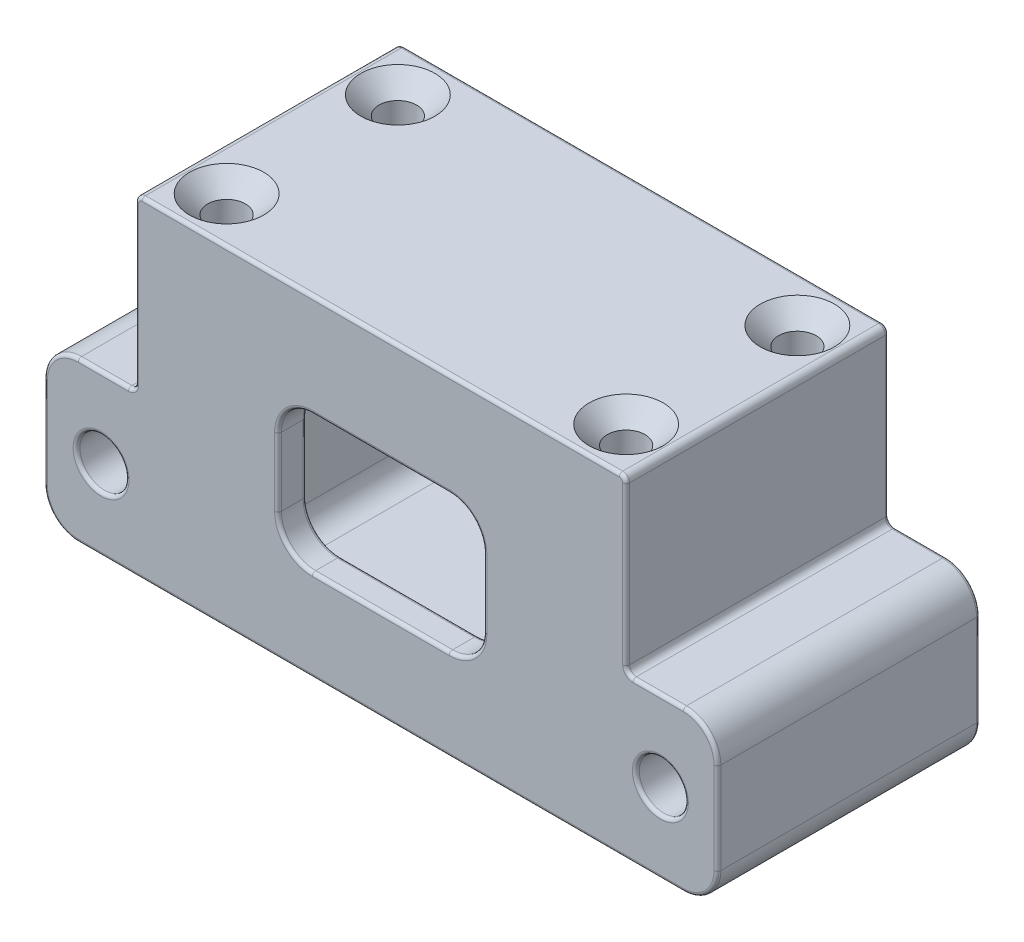
from build123d import *

# Parameters (mm, degrees)
SKETCH1_W           = 43
SKETCH1_H           = 29
BOSS_EXTRUDE1_DEPTH = 23
SKETCH2_W           = 31
SKETCH2_H           = 23
CUT_EXTRUDE1_DEPTH  = 2
FILLET1_R           = 2.5
FILLET2_R           = 2
SKETCH3_W           = 27
SKETCH3_H           = 20
CUT_EXTRUDE2_DEPTH  = 15.2
FILLET3_R           = 2
SKETCH4_W           = 31
SKETCH4_H           = 24
CUT_EXTRUDE3_DEPTH  = 3.3
CUT_EXTRUDE4_REACH  = 35.057
SKETCH5_W           = 18
SKETCH5_H           = 12
FILLET4_R           = 4
FILLET5_R           = 3
SKETCH6_R           = 1.65
CUT_EXTRUDE5_DEPTH  = 36.3
CUT_EXTRUDE6_DEPTH  = 3
CHAMFER1_SIZE       = 1.6
SKETCH9_W           = 23
SKETCH9_H           = 14
BOSS_EXTRUDE2_DEPTH = 8
SKETCH10_R          = 2.15
CUT_EXTRUDE7_DEPTH  = 37
CUT_EXTRUDE8_DEPTH  = 4
FILLET6_R           = 3
FILLET7_R           = 0.6
FILLET8_R           = 0.3


with BuildPart() as part:
    # Sketch1 → Boss-Extrude1 (new body)
    with BuildSketch(Plane.XY):
        Rectangle(SKETCH1_W, SKETCH1_H)
    extrude(amount=BOSS_EXTRUDE1_DEPTH)

    # Sketch2 → Cut-Extrude1 (cut)
    with BuildSketch(Plane(origin=(0, 0, 0), x_dir=(-1, 0, 0), z_dir=(0, 0, -1))):
        Rectangle(SKETCH2_W, SKETCH2_H)
    extrude(amount=-CUT_EXTRUDE1_DEPTH, mode=Mode.SUBTRACT)

    # Fillet1
    fillet1_edges = [part.edges().sort_by_distance(p)[0] for p in [
        (-15.5, 11.5, 1),
        (15.5, 11.5, 1),
    ]]
    fillet(fillet1_edges, radius=FILLET1_R)

    # Fillet2
    fillet2_edges = [part.edges().sort_by_distance(p)[0] for p in [
        (-15.5, -11.5, 1),
        (15.5, -11.5, 1),
    ]]
    fillet(fillet2_edges, radius=FILLET2_R)

    # Sketch3 → Cut-Extrude2 (cut)
    with BuildSketch(Plane(origin=(0, 0, 2), x_dir=(-1, 0, 0), z_dir=(0, 0, -1))):
        with Locations((0, -0.5)):
            Rectangle(SKETCH3_W, SKETCH3_H)
    extrude(amount=-CUT_EXTRUDE2_DEPTH, mode=Mode.SUBTRACT)

    # Fillet3
    fillet3_edges = [part.edges().sort_by_distance(p)[0] for p in [
        (-13.5, 9.5, 9.6),
        (-13.5, -10.5, 9.6),
        (13.5, -10.5, 9.6),
        (13.5, 9.5, 9.6),
    ]]
    fillet(fillet3_edges, radius=FILLET3_R)

    # Sketch4 → Cut-Extrude3 (cut)
    with BuildSketch(Plane(origin=(0, 0, 17.2), x_dir=(-1, 0, 0), z_dir=(0, 0, -1))):
        with Locations((0, -0.5)):
            Rectangle(SKETCH4_W, SKETCH4_H)
    extrude(amount=-CUT_EXTRUDE3_DEPTH, mode=Mode.SUBTRACT)

    # Sketch5 → Cut-Extrude4 (cut, up to next)
    with BuildSketch(Plane(origin=(0, 0, 20.5), x_dir=(-1, 0, 0), z_dir=(0, 0, -1)), mode=Mode.PRIVATE) as cut_extrude4_sk1:
        with Locations((0, -0.5)):
            Rectangle(SKETCH5_W, SKETCH5_H)
    cut_extrude4_tool1 = extrude(cut_extrude4_sk1.sketch, amount=-CUT_EXTRUDE4_REACH, mode=Mode.PRIVATE) & part.part
    add(cut_extrude4_tool1.solids().sort_by_distance((0, -0.5, 20.5))[0], mode=Mode.SUBTRACT)

    # Fillet4
    fillet4_edges = [part.edges().sort_by_distance(p)[0] for p in [
        (-15.5, -12.5, 18.85),
        (15.5, -12.5, 18.85),
        (15.5, 11.5, 18.85),
        (-15.5, 11.5, 18.85),
    ]]
    fillet(fillet4_edges, radius=FILLET4_R)

    # Fillet5
    fillet5_edges = [part.edges().sort_by_distance(p)[0] for p in [
        (9, 5.5, 21.75),
        (9, -6.5, 21.75),
        (-9, -6.5, 21.75),
        (-9, 5.5, 21.75),
    ]]
    fillet(fillet5_edges, radius=FILLET5_R)

    # Sketch6 → Cut-Extrude5 (cut)
    with BuildSketch(Plane(origin=(0, 14.5, 0), x_dir=(1, 0, 0), z_dir=(0, 1, 0))):
        with Locations((-17.5, -4)):
            Circle(SKETCH6_R)
        with Locations((-17.5, -19)):
            Circle(SKETCH6_R)
        with Locations((17.5, -19)):
            Circle(SKETCH6_R)
        with Locations((17.5, -4)):
            Circle(SKETCH6_R)
    extrude(amount=-CUT_EXTRUDE5_DEPTH, mode=Mode.SUBTRACT)

    # Sketch8 → Cut-Extrude6 (cut)
    with BuildSketch(Plane.XZ.offset(14.5)):
        Polygon((-17.5, 15.535898385), (-14.5, 17.267949192), (-14.5, 20.732050808), (-17.5, 22.464101615), (-20.5, 20.732050808), (-20.5, 17.267949192), align=None)
        Polygon((-17.5, 7.464101615), (-20.5, 5.732050808), (-20.5, 2.267949192), (-17.5, 0.535898385), (-14.5, 2.267949192), (-14.5, 5.732050808), align=None)
        Polygon((17.5, 7.464101615), (14.5, 5.732050808), (14.5, 2.267949192), (17.5, 0.535898385), (20.5, 2.267949192), (20.5, 5.732050808), align=None)
        Polygon((17.5, 15.535898385), (20.5, 17.267949192), (20.5, 20.732050808), (17.5, 22.464101615), (14.5, 20.732050808), (14.5, 17.267949192), align=None)
    extrude(amount=-CUT_EXTRUDE6_DEPTH, mode=Mode.SUBTRACT)

    # Chamfer1
    chamfer1_edges = [part.edges().sort_by_distance(p)[0] for p in [
        (15.85, 14.5, 4),
        (15.85, 14.5, 19),
        (-19.15, 14.5, 19),
        (-19.15, 14.5, 4),
    ]]
    chamfer(chamfer1_edges, length=CHAMFER1_SIZE)

    # Sketch9 → Boss-Extrude2 (add)
    with BuildSketch(Plane(origin=(21.5, 0, 0), x_dir=(0, 0, -1), z_dir=(1, 0, 0))):
        with Locations((-11.5, -7.5)):
            Rectangle(SKETCH9_W, SKETCH9_H)
    boss_extrude2 = extrude(amount=BOSS_EXTRUDE2_DEPTH)

    # Mirror1: Boss-Extrude2 across plane
    add(boss_extrude2.mirror(Plane(origin=(0, 0, 0), x_dir=(0, 0, 1), z_dir=(1, 0, 0))))

    # Sketch10 → Cut-Extrude7 (cut)
    with BuildSketch(Plane.XY.offset(23)):
        with Locations((-24.5, -7.5)):
            Circle(SKETCH10_R)
        with Locations((24.5, -7.5)):
            Circle(SKETCH10_R)
    extrude(amount=-CUT_EXTRUDE7_DEPTH, mode=Mode.SUBTRACT)

    # Sketch11 → Cut-Extrude8 (cut)
    with BuildSketch(Plane(origin=(0, 0, 0), x_dir=(-1, 0, 0), z_dir=(0, 0, -1))):
        Polygon((-24.5, -11.656921938), (-20.9, -9.578460969), (-20.9, -5.421539031), (-24.5, -3.343078062), (-28.1, -5.421539031), (-28.1, -9.578460969), align=None)
        Polygon((24.5, -11.656921938), (28.1, -9.578460969), (28.1, -5.421539031), (24.5, -3.343078062), (20.9, -5.421539031), (20.9, -9.578460969), align=None)
    extrude(amount=-CUT_EXTRUDE8_DEPTH, mode=Mode.SUBTRACT)

    # Fillet6
    fillet6_edges = [part.edges().sort_by_distance(p)[0] for p in [
        (-29.5, -14.5, 11.5),
        (-29.5, -0.5, 11.5),
        (29.5, -0.5, 11.5),
        (29.5, -14.5, 11.5),
    ]]
    fillet(fillet6_edges, radius=FILLET6_R)

    # Fillet7
    fillet7_edges = [part.edges().sort_by_distance(p)[0] for p in [
        (21.5, 14.5, 11.5),
        (-21.5, 14.5, 11.5),
        (-21.5, -0.5, 11.5),
        (21.5, -0.5, 11.5),
    ]]
    fillet(fillet7_edges, radius=FILLET7_R)

    # Fillet8
    fillet8_edges = [part.edges().sort_by_distance(p)[0] for p in [
        (8.121320344, 4.621320344, 20.5),
        (0, 5.5, 20.5),
        (-8.121320344, 4.621320344, 20.5),
        (-9, -0.5, 20.5),
        (-8.121320344, -5.621320344, 20.5),
        (0, -6.5, 20.5),
        (8.121320344, -5.621320344, 20.5),
        (12.914213562, 8.914213562, 17.2),
        (0, 9.5, 17.2),
        (-12.914213562, 8.914213562, 17.2),
        (-13.5, -0.5, 17.2),
        (-12.914213562, -9.914213562, 17.2),
        (0, -10.5, 17.2),
        (12.914213562, -9.914213562, 17.2),
        (12.914213562, -9.914213562, 2),
        (13.5, -0.5, 2),
        (12.914213562, 8.914213562, 2),
        (0, 9.5, 2),
        (-12.914213562, 8.914213562, 2),
        (-13.5, -0.5, 2),
        (-12.914213562, -9.914213562, 2),
        (-21.324264069, 14.324264069, 0),
        (-21.5, 7, 0),
        (-21.675735931, -0.324264069, 0),
        (-24.3, -0.5, 0),
        (-28.621320344, -1.378679656, 0),
        (-29.5, -7.5, 0),
        (-28.621320344, -13.621320344, 0),
        (0, -14.5, 0),
        (28.621320344, -13.621320344, 0),
        (29.5, -7.5, 0),
        (28.621320344, -1.378679656, 0),
        (24.3, -0.5, 0),
        (21.675735931, -0.324264069, 0),
        (21.5, 7, 0),
        (21.324264069, 14.324264069, 0),
        (0, 14.5, 0),
        (14.767766953, 10.767766953, 0),
        (15.5, -0.25, 0),
        (14.914213562, -10.914213562, 0),
        (0, -11.5, 0),
        (-14.914213562, -10.914213562, 0),
        (-15.5, -0.25, 0),
        (-14.767766953, 10.767766953, 0),
        (0, 11.5, 0),
        (-28.1, -7.5, 0),
        (-26.3, -4.382308546, 0),
        (-22.7, -4.382308546, 0),
        (-20.9, -7.5, 0),
        (-22.7, -10.617691454, 0),
        (-26.3, -10.617691454, 0),
        (20.9, -7.5, 0),
        (22.7, -4.382308546, 0),
        (26.3, -4.382308546, 0),
        (28.1, -7.5, 0),
        (26.3, -10.617691454, 0),
        (22.7, -10.617691454, 0),
        (21.675735931, -0.324264069, 23),
        (24.3, -0.5, 23),
        (28.621320344, -1.378679656, 23),
        (29.5, -7.5, 23),
        (28.621320344, -13.621320344, 23),
        (0, -14.5, 23),
        (-28.621320344, -13.621320344, 23),
        (-29.5, -7.5, 23),
        (-28.621320344, -1.378679656, 23),
        (-24.3, -0.5, 23),
        (-21.675735931, -0.324264069, 23),
        (-21.5, 7, 23),
        (-21.324264069, 14.324264069, 23),
        (0, 14.5, 23),
        (21.324264069, 14.324264069, 23),
        (21.5, 7, 23),
        (8.121320344, -5.621320344, 23),
        (9, -0.5, 23),
        (8.121320344, 4.621320344, 23),
        (0, 5.5, 23),
        (-8.121320344, 4.621320344, 23),
        (-9, -0.5, 23),
        (-8.121320344, -5.621320344, 23),
        (0, -6.5, 23),
        (22.35, -7.5, 23),
        (-26.65, -7.5, 23),
        (9, -0.5, 20.5),
        (13.5, -0.5, 17.2),
        (0, -10.5, 2),
    ]]
    fillet(fillet8_edges, radius=FILLET8_R)


solid = part.part
